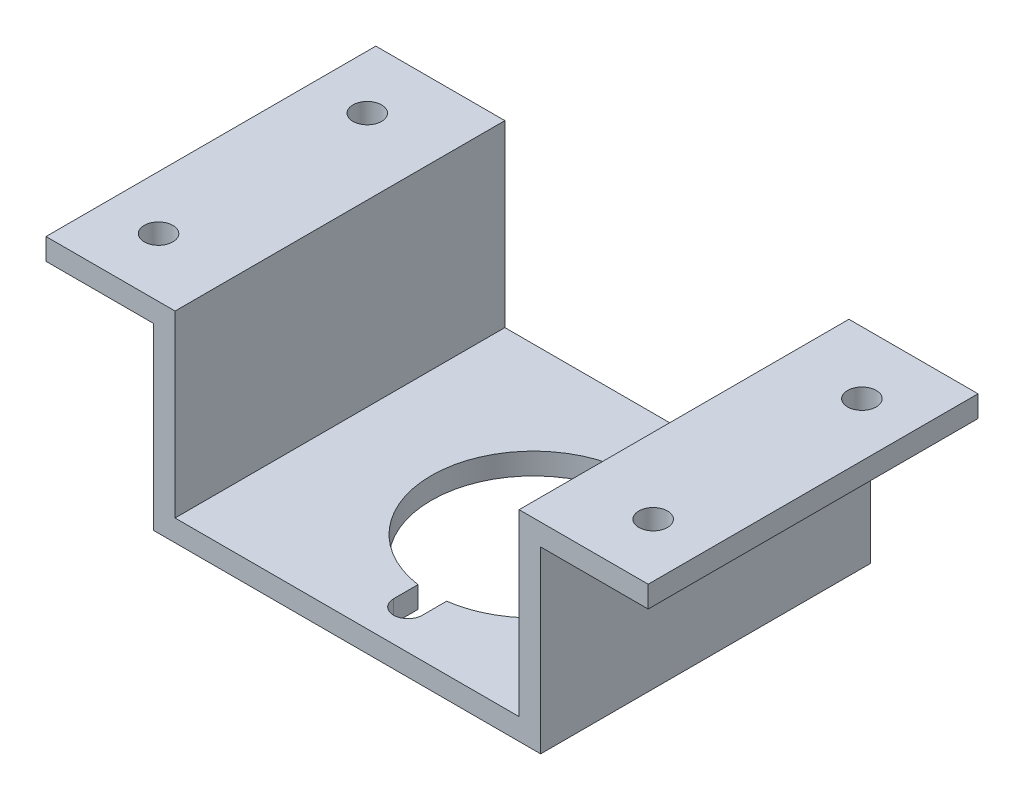
from build123d import *

# Parameters (mm, degrees)
SKETCH1_W           = 50
SKETCH1_H           = 40
BOSS_EXTRUDE1_DEPTH = 3
SKETCH6_R           = 2
CUT_EXTRUDE9_DEPTH  = 5
SKETCH16_W          = 14.8
SKETCH16_H          = 3
CUT_EXTRUDE10_DEPTH = 0.5
SKETCH21_R          = 14.25
CUT_EXTRUDE15_DEPTH = 4
CUT_EXTRUDE16_START = -4
CUT_EXTRUDE16_DEPTH = 4
SKETCH33_W          = 4
SKETCH33_H          = 35
CUT_EXTRUDE23_DEPTH = 5
SKETCH34_W          = 49.986920535
SKETCH34_H          = 3
BOSS_EXTRUDE2_DEPTH = 3
SKETCH35_W          = 50
SKETCH35_H          = 3
BOSS_EXTRUDE3_DEPTH = 3
SKETCH36_W          = 46
SKETCH36_H          = 3
BOSS_EXTRUDE4_DEPTH = 4
SKETCH38_W          = 3
SKETCH38_H          = 46
BOSS_EXTRUDE5_DEPTH = 25
SKETCH39_W          = 45.535565308
SKETCH39_H          = 3
BOSS_EXTRUDE6_DEPTH = 15
SKETCH40_W          = 46
SKETCH40_H          = 3
BOSS_EXTRUDE7_DEPTH = 15
SKETCH41_W          = 0.464434692
SKETCH41_H          = 3
BOSS_EXTRUDE8_DEPTH = 15
SKETCH42_R          = 2
CUT_EXTRUDE24_DEPTH = 15
SKETCH43_R          = 2
CUT_EXTRUDE25_DEPTH = 15


with BuildPart() as part:
    # Sketch1 → Boss-Extrude1 (new body)
    with BuildSketch(Plane(origin=(0, 0, 0), x_dir=(1, 0, 0), z_dir=(0, 1, 0))):
        with Locations((1.920937393, -5.615172506)):
            Rectangle(SKETCH1_W, SKETCH1_H)
    extrude(amount=BOSS_EXTRUDE1_DEPTH)

    # Sketch6 → Cut-Extrude9 (cut)
    with BuildSketch(Plane.XZ):
        with Locations(Location((6.920937393, 23.115172506, 0), (0, 0, 270))):
            Circle(SKETCH6_R)
        with Locations(Location((6.920937393, -11.884827494, 0), (0, 0, 270))):
            Circle(SKETCH6_R)
        with BuildLine():
            Line((24.420937393, 13.015172506), (18.923020545, 13.015172506))
            ThreePointArc((18.923020545, 13.015172506), (-7.179062607, 5.615172506), (18.923020545, -1.784827494))
            Line((18.923020545, -1.784827494), (24.420937393, -1.784827494))
            Line((24.420937393, -1.784827494), (24.420937393, 5.615172506))
            Line((24.420937393, 5.615172506), (24.420937393, 13.015172506))
        make_face()
    extrude(amount=-CUT_EXTRUDE9_DEPTH, mode=Mode.SUBTRACT)

    # Sketch16 → Cut-Extrude10 (cut)
    with BuildSketch(Plane.ZY.offset(-24.420937393)):
        with Locations((5.615172506, 1.5)):
            Rectangle(SKETCH16_W, SKETCH16_H)
    extrude(amount=-CUT_EXTRUDE10_DEPTH, mode=Mode.SUBTRACT)

    # Sketch21 → Cut-Extrude15 (cut)
    with BuildSketch(Plane(origin=(0, 0, 0), x_dir=(-1, 0, 0), z_dir=(0, -1, 0))):
        with Locations((-6.920937393, -5.615172506)):
            Circle(SKETCH21_R)
    extrude(amount=-CUT_EXTRUDE15_DEPTH, mode=Mode.SUBTRACT)

    # Sketch22 → Cut-Extrude16 (cut)
    with BuildSketch(Plane(origin=(0, 3, 0), x_dir=(1, 0, 0), z_dir=(0, 1, 0)).offset(CUT_EXTRUDE16_START)):
        with BuildLine():
            ThreePointArc((21.106680727, 1.784827494), (20.39103932, 3.019158274), (19.568281538, 4.184827494))
            Line((19.568281538, 4.184827494), (17.266105347, 4.184827494))
            ThreePointArc((17.266105347, 4.184827494), (18.246250908, 3.03351374), (19.09888878, 1.784827494))
            Line((19.09888878, 1.784827494), (21.106680727, 1.784827494))
        make_face()
        with BuildLine():
            Line((17.266105347, -15.415172506), (19.568281538, -15.415172506))
            ThreePointArc((19.568281538, -15.415172506), (20.39103932, -14.249503286), (21.106680727, -13.015172506))
            Line((21.106680727, -13.015172506), (19.09888878, -13.015172506))
            ThreePointArc((19.09888878, -13.015172506), (18.246250908, -14.263858752), (17.266105347, -15.415172506))
        make_face()
    extrude(amount=CUT_EXTRUDE16_DEPTH, mode=Mode.SUBTRACT)

    # Sketch33 → Cut-Extrude23 (cut)
    with BuildSketch(Plane(origin=(0, 3, 0), x_dir=(1, 0, 0), z_dir=(0, 1, 0))):
        with Locations((6.920937393, -5.615172506)):
            Rectangle(SKETCH33_W, SKETCH33_H)
    extrude(amount=-CUT_EXTRUDE23_DEPTH, mode=Mode.SUBTRACT)

    # Sketch34 → Boss-Extrude2 (add)
    with BuildSketch(Plane(origin=(0, 0, -14.384827494), x_dir=(-1, 0, 0), z_dir=(0, 0, -1))):
        with Locations((-1.927477126, 1.5)):
            Rectangle(SKETCH34_W, SKETCH34_H)
    extrude(amount=BOSS_EXTRUDE2_DEPTH)

    # Sketch35 → Boss-Extrude3 (add)
    with BuildSketch(Plane.XY.offset(25.615172506)):
        with Locations((1.920937393, 1.5)):
            Rectangle(SKETCH35_W, SKETCH35_H)
    extrude(amount=BOSS_EXTRUDE3_DEPTH)

    # Sketch36 → Boss-Extrude4 (add)
    with BuildSketch(Plane(origin=(26.920937393, 0, 0), x_dir=(0, 0, -1), z_dir=(1, 0, 0))):
        with Locations((-5.615172506, 1.5)):
            Rectangle(SKETCH36_W, SKETCH36_H)
    extrude(amount=BOSS_EXTRUDE4_DEPTH)

    # Sketch38 → Boss-Extrude5 (add)
    with BuildSketch(Plane(origin=(0, 3, 0), x_dir=(1, 0, 0), z_dir=(0, 1, 0))):
        with Locations((29.420937393, -5.615172506)):
            Rectangle(SKETCH38_W, SKETCH38_H)
        with Locations((-21.565983142, -5.615172506)):
            Rectangle(SKETCH38_W, SKETCH38_H)
    extrude(amount=BOSS_EXTRUDE5_DEPTH)

    # Sketch39 → Boss-Extrude6 (add)
    with BuildSketch(Plane.ZY.offset(23.065983142)):
        with Locations((5.38295516, 26.5)):
            Rectangle(SKETCH39_W, SKETCH39_H)
    extrude(amount=BOSS_EXTRUDE6_DEPTH)

    # Sketch40 → Boss-Extrude7 (add)
    with BuildSketch(Plane(origin=(30.920937393, 0, 0), x_dir=(0, 0, -1), z_dir=(1, 0, 0))):
        with Locations((-5.615172506, 26.5)):
            Rectangle(SKETCH40_W, SKETCH40_H)
    extrude(amount=BOSS_EXTRUDE7_DEPTH)

    # Sketch41 → Boss-Extrude8 (add)
    with BuildSketch(Plane.ZY.offset(23.065983142)):
        with Locations((28.38295516, 26.5)):
            Rectangle(SKETCH41_W, SKETCH41_H)
    extrude(amount=BOSS_EXTRUDE8_DEPTH)

    # Sketch42 → Cut-Extrude24 (cut)
    with BuildSketch(Plane.XZ.offset(-25)):
        with Locations(Location((38.420937393, 20.419520332, 0), (0, 0, 270))):
            Circle(SKETCH42_R)
        with Locations(Location((38.420937393, -8.692413747, 0), (0, 0, 270))):
            Circle(SKETCH42_R)
    extrude(amount=-CUT_EXTRUDE24_DEPTH, mode=Mode.SUBTRACT)

    # Sketch43 → Cut-Extrude25 (cut)
    with BuildSketch(Plane.XZ.offset(-25)):
        with Locations(Location((-30.565983142, 20.419520332, 0), (0, 0, 270))):
            Circle(SKETCH43_R)
        with Locations(Location((-30.565983142, -8.692413747, 0), (0, 0, 270))):
            Circle(SKETCH43_R)
    extrude(amount=-CUT_EXTRUDE25_DEPTH, mode=Mode.SUBTRACT)


solid = part.part
